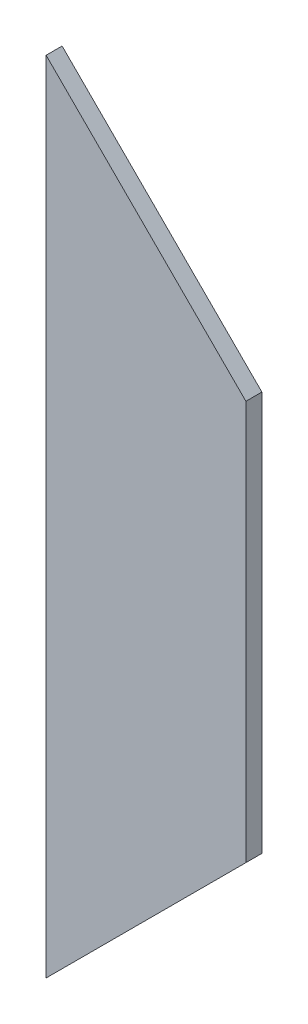
from build123d import *

# Parameters (mm, degrees)
EXTRUDE_1_DEPTH = 4


with BuildPart() as part:
    # Эскиз1 → Бобышка-Вытянуть1 (new body)
    with BuildSketch(Plane.XY):
        Polygon((0, 0), (0, 200), (50, 150), (50, 50), align=None)
    extrude(amount=EXTRUDE_1_DEPTH)


solid = part.part
